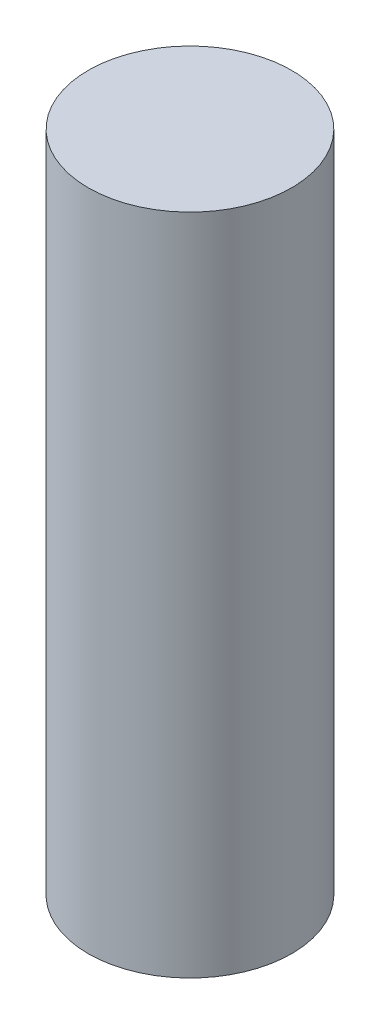
from build123d import *

# Parameters (mm, degrees)
SKETCH1_R           = 6.35
BOSS_EXTRUDE1_DEPTH = 41.402


with BuildPart() as part:
    # Sketch1 → Boss-Extrude1 (new body)
    with BuildSketch(Plane(origin=(0, 0, 0), x_dir=(1, 0, 0), z_dir=(0, 1, 0))):
        with Locations(Location((0, 0, 0), (0, 0, 270))):
            Circle(SKETCH1_R)
    extrude(amount=BOSS_EXTRUDE1_DEPTH)


solid = part.part
